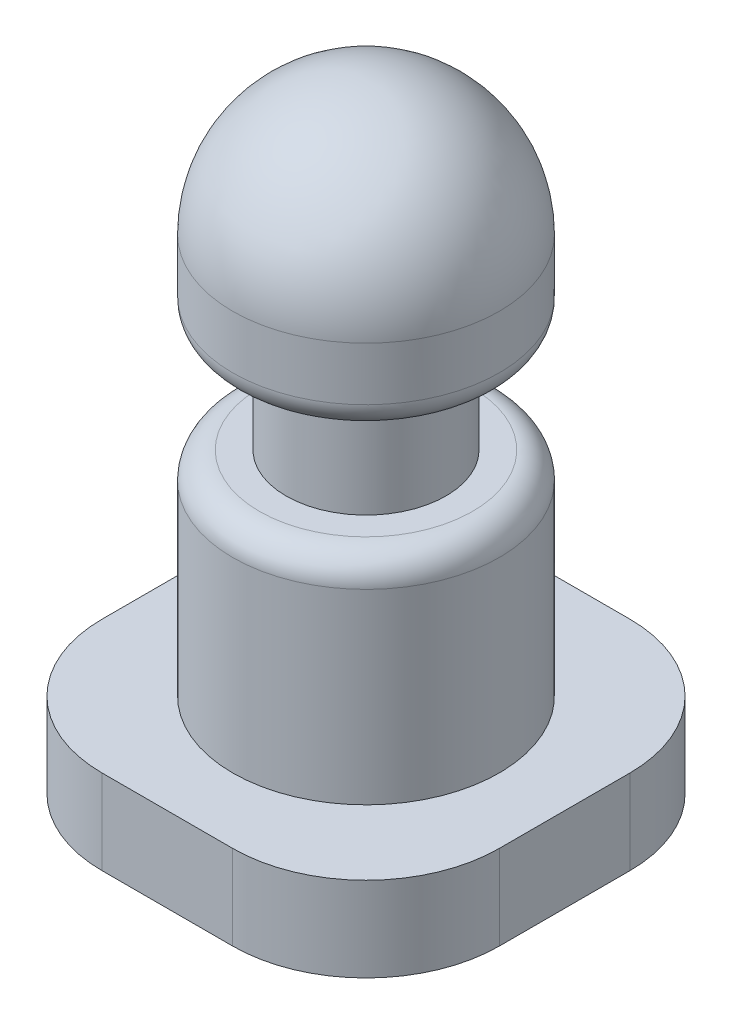
from build123d import *

# Parameters (mm, degrees)
SKETCH2_W               = 29.8
SKETCH2_H               = 29.8
BOSS_EXTRUDE1_DEPTH     = 6.35
FILLET1_R               = 10
SKETCH9_R               = 10
BOSS_EXTRUDE6_DEPTH     = 40
FILLET5_R               = 10
CUT_EXTRUDE2_DEPTH      = 4
CUT_EXTRUDE2_DEPTH_BACK = 4
SKETCH11_R              = 10
SKETCH11_R_2            = 6
FILLET6_R               = 2
SKETCH12_R              = 2.1225
CUT_EXTRUDE3_DEPTH      = 5


with BuildPart() as part:
    # Sketch2 → Boss-Extrude1 (new body)
    with BuildSketch(Plane(origin=(0, 0, 0), x_dir=(1, 0, 0), z_dir=(0, 1, 0))):
        Rectangle(SKETCH2_W, SKETCH2_H)
    extrude(amount=BOSS_EXTRUDE1_DEPTH)

    # Fillet1
    fillet1_edges = [part.edges().sort_by_distance(p)[0] for p in [
        (14.9, 3.175, 14.9),
        (-14.9, 3.175, 14.9),
        (-14.9, 3.175, -14.9),
        (14.9, 3.175, -14.9),
    ]]
    fillet(fillet1_edges, radius=FILLET1_R)

    # Sketch9 → Boss-Extrude6 (add)
    with BuildSketch(Plane(origin=(0, 6.35, 0), x_dir=(1, 0, 0), z_dir=(0, 1, 0))):
        Circle(SKETCH9_R)
    extrude(amount=BOSS_EXTRUDE6_DEPTH)

    # Fillet5
    fillet5_edges = [part.edges().sort_by_distance(p)[0] for p in [
        (-10, 46.35, 0),
    ]]
    fillet(fillet5_edges, radius=FILLET5_R)

    # Sketch11 → Cut-Extrude2 (cut, two sides: drawn at the far end of the back side and taken through both)
    with BuildSketch(Plane(origin=(0, 26.35, 0), x_dir=(1, 0, 0), z_dir=(0, 1, 0)).offset(-CUT_EXTRUDE2_DEPTH_BACK)):
        Circle(SKETCH11_R)
        Circle(SKETCH11_R_2, mode=Mode.SUBTRACT)
    extrude(amount=CUT_EXTRUDE2_DEPTH + CUT_EXTRUDE2_DEPTH_BACK, mode=Mode.SUBTRACT)

    # Fillet6
    fillet6_edges = [part.edges().sort_by_distance(p)[0] for p in [
        (-10, 30.35, 0),
        (-10, 22.35, 0),
    ]]
    fillet(fillet6_edges, radius=FILLET6_R)

    # Sketch12 → Cut-Extrude3 (cut)
    with BuildSketch(Plane.XZ):
        Circle(SKETCH12_R)
    extrude(amount=-CUT_EXTRUDE3_DEPTH, mode=Mode.SUBTRACT)


solid = part.part
